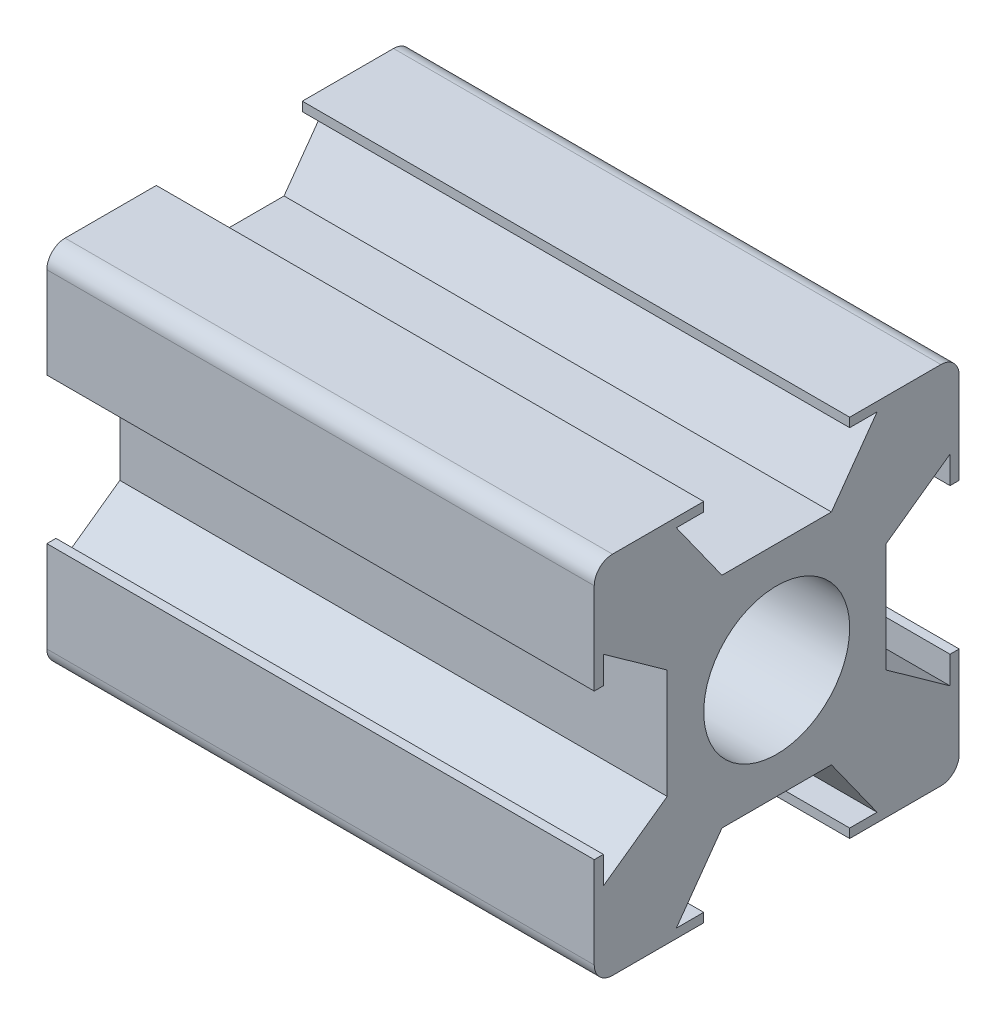
from build123d import *

# Parameters (mm, degrees)
SKETCH_1_W                       = 30
SKETCH_1_H                       = 10
EXTRUDE_1_DEPTH                  = 10
SKETCH_2_R                       = 4
CUT_EXTRUDE_1_DEPTH              = 1270
CUT_EXTRUDE_2_DEPTH              = 1270
FILLET_1_R                       = 1
PATTERN_CIRCULAR_2_COUNT         = 4
FILLET_1_OF_PATTERN_CIRCULAR_2_R = 1


with BuildPart() as part:
    # 草图1 → 凸台-拉伸1 (new body)
    with BuildSketch(Plane.XY):
        with Locations((-51.518714647, -6.397869645)):
            Rectangle(SKETCH_1_W, SKETCH_1_H)
    extrude_1 = extrude(amount=EXTRUDE_1_DEPTH)

    # 草图2 → 切除-拉伸1 (cut)
    with BuildSketch(Plane(origin=(-36.518714647, 0, 0), x_dir=(0, 0, -1), z_dir=(1, 0, 0))):
        with Locations((0, -11.397869645)):
            Circle(SKETCH_2_R)
    cut_extrude_1 = extrude(amount=-CUT_EXTRUDE_1_DEPTH, mode=Mode.SUBTRACT)

    # 草图3 → 切除-拉伸2 (cut)
    with BuildSketch(Plane(origin=(-36.518714647, 0, 0), x_dir=(0, 0, -1), z_dir=(1, 0, 0))):
        Polygon((-4, -1.397869645), (0, -1.397869645), (0, -5.397869645), (-3, -5.397869645), (-5.5, -1.897869645), (-4, -1.897869645), align=None)
        Polygon((-10, -7.397869645), (-10, -11.397869645), (-6, -11.397869645), (-6, -8.397869645), (-9.5, -5.897869645), (-9.5, -7.397869645), align=None)
    cut_extrude_2 = extrude(amount=-CUT_EXTRUDE_2_DEPTH, mode=Mode.SUBTRACT)

    # 圆角1
    fillet_1_edges = [part.edges().sort_by_distance(p)[0] for p in [
        (-51.518714647, -1.397869645, 10),
    ]]
    fillet(fillet_1_edges, radius=FILLET_1_R)

    # 阵列(圆周)2: 凸台-拉伸1, 切除-拉伸1, 切除-拉伸2 ×4 about axis
    pattern_circular_2_axis = Axis((0, -11.397869645, 0), (1, 0, 0))
    add([extrude_1.rotate(pattern_circular_2_axis, i * 360 / PATTERN_CIRCULAR_2_COUNT) for i in range(1, PATTERN_CIRCULAR_2_COUNT)])
    add([cut_extrude_1.rotate(pattern_circular_2_axis, i * 360 / PATTERN_CIRCULAR_2_COUNT) for i in range(1, PATTERN_CIRCULAR_2_COUNT)], mode=Mode.SUBTRACT)
    add([cut_extrude_2.rotate(pattern_circular_2_axis, i * 360 / PATTERN_CIRCULAR_2_COUNT) for i in range(1, PATTERN_CIRCULAR_2_COUNT)], mode=Mode.SUBTRACT)

    # 圆角1 of 阵列(圆周)2
    fillet_1_of_pattern_circular_2_edges = [part.edges().sort_by_distance(p)[0] for p in [
        (-51.518714647, -21.397869645, 10),
        (-51.518714647, -21.397869645, -10),
        (-51.518714647, -1.397869645, -10),
    ]]
    fillet(fillet_1_of_pattern_circular_2_edges, radius=FILLET_1_OF_PATTERN_CIRCULAR_2_R)


solid = part.part
